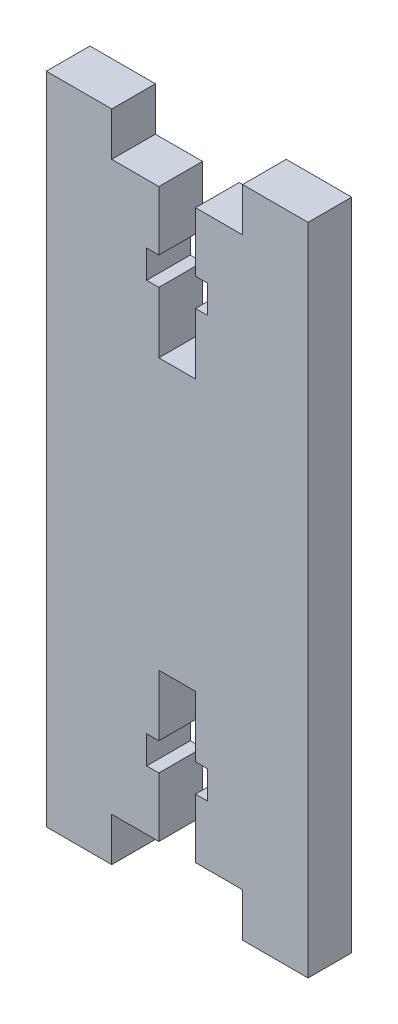
from build123d import *

# Parameters (mm, degrees)
SKETCH1_W           = 7.5
SKETCH1_H           = 5
BOSS_EXTRUDE1_DEPTH = 5


with BuildPart() as part:
    # Sketch1 → Boss-Extrude1 (new body)
    with BuildSketch(Plane.XY):
        Polygon((-7.5, 0), (0, 0), (0, 65), (-7.5, 65), (-12.9, 65), (-12.9, 58.2), (-11.5, 58.2), (-11.5, 55), (-12.9, 55), (-12.9, 48), (-17.1, 48), (-17.1, 55), (-18.5, 55), (-18.5, 58.2), (-17.1, 58.2), (-17.1, 65), (-22.5, 65), (-30, 65), (-30, 0), (-22.5, 0), (-17.1, 0), (-17.1, 6.8), (-18.5, 6.8), (-18.5, 10), (-17.1, 10), (-17.1, 17), (-12.9, 17), (-12.9, 10), (-11.5, 10), (-11.5, 6.8), (-12.9, 6.8), (-12.9, 0), align=None)
        with Locations((-3.75, 67.5)):
            Rectangle(SKETCH1_W, SKETCH1_H)
        with Locations((-26.25, 67.5)):
            Rectangle(SKETCH1_W, SKETCH1_H)
        with Locations((-26.25, -2.5)):
            Rectangle(SKETCH1_W, SKETCH1_H)
        with Locations((-3.75, -2.5)):
            Rectangle(SKETCH1_W, SKETCH1_H)
    extrude(amount=BOSS_EXTRUDE1_DEPTH)


solid = part.part
